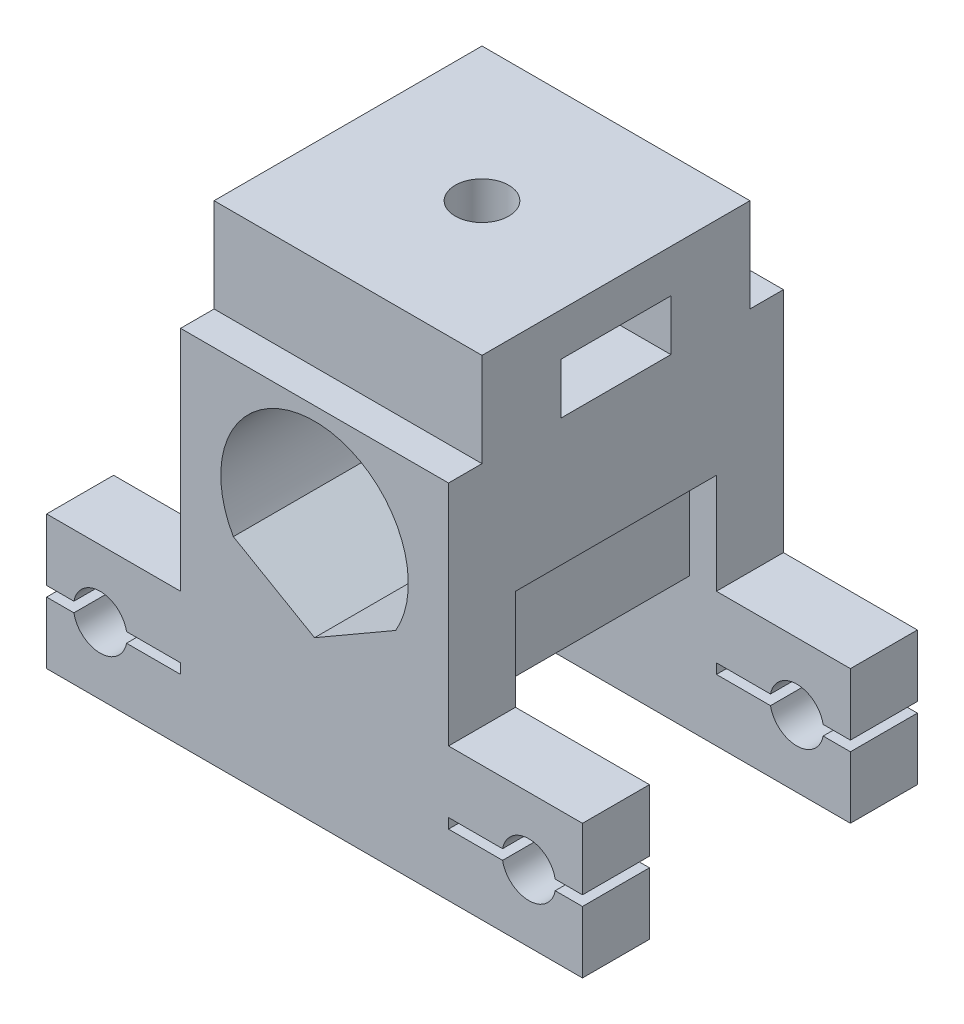
from build123d import *

# Parameters (mm, degrees)
SKETCH1_W               = 20
SKETCH1_H               = 25
BOSS_EXTRUDE1_DEPTH     = 17
CUT_EXTRUDE1_DEPTH      = 32.843366656
BOSS_EXTRUDE2_DEPTH     = 5
SKETCH4_R               = 2
CUT_EXTRUDE2_DEPTH      = 37.249137921
SKETCH6_W               = 20
SKETCH6_H               = 20
BOSS_EXTRUDE3_DEPTH     = 7
SKETCH8_W               = 8.2
SKETCH8_H               = 3.8
CUT_EXTRUDE3_DEPTH      = 41.401113846
CUT_EXTRUDE4_REACH      = 43.379
CUT_EXTRUDE4_END_RADIUS = 7
SKETCH7_R               = 2
SKETCH9_W               = 15
SKETCH9_H               = 7.5
CUT_EXTRUDE5_DEPTH      = 2
SKETCH10_W              = 10
SKETCH10_H              = 0.75
CUT_EXTRUDE6_DEPTH      = 41.01249811


with BuildPart() as part:
    # Sketch1 → Boss-Extrude1 (new body)
    with BuildSketch(Plane(origin=(0, 0, 0), x_dir=(1, 0, 0), z_dir=(0, 1, 0))):
        Rectangle(SKETCH1_W, SKETCH1_H)
    extrude(amount=BOSS_EXTRUDE1_DEPTH)

    # Sketch2 → Cut-Extrude1 (cut, through all)
    with BuildSketch(Plane.XY.offset(12.5)):
        with BuildLine():
            Line((0, 2), (-6.062177826, 5.5))
            ThreePointArc((-6.062177826, 5.5), (0, 16), (6.062177826, 5.5))
            Line((6.062177826, 5.5), (0, 2))
        make_face()
    extrude(amount=-CUT_EXTRUDE1_DEPTH, mode=Mode.SUBTRACT)

    # Sketch3 → Boss-Extrude2 (add)
    with BuildSketch(Plane.XY.offset(12.5)):
        Polygon((10, 0), (20, 0), (20, -10), (-20, -10), (-20, 0), (-10, 0), align=None)
    boss_extrude2 = extrude(amount=-BOSS_EXTRUDE2_DEPTH)

    # Mirror1: Boss-Extrude2 across plane
    add(boss_extrude2.mirror(Plane.XY))

    # Sketch4 → Cut-Extrude2 (cut, through all)
    with BuildSketch(Plane.XY.offset(12.5)):
        with Locations((16, -5)):
            Circle(SKETCH4_R)
        with Locations((-16, -5)):
            Circle(SKETCH4_R)
    extrude(amount=-CUT_EXTRUDE2_DEPTH, mode=Mode.SUBTRACT)

    # Sketch6 → Boss-Extrude3 (add)
    with BuildSketch(Plane(origin=(0, 17, 0), x_dir=(1, 0, 0), z_dir=(0, 1, 0))):
        Rectangle(SKETCH6_W, SKETCH6_H)
    extrude(amount=BOSS_EXTRUDE3_DEPTH)

    # Sketch8 → Cut-Extrude3 (cut, through all)
    with BuildSketch(Plane(origin=(10, 0, 0), x_dir=(0, 0, -1), z_dir=(1, 0, 0))):
        with Locations((0, 18.9)):
            Rectangle(SKETCH8_W, SKETCH8_H)
    extrude(amount=-CUT_EXTRUDE3_DEPTH, mode=Mode.SUBTRACT)

    # Cut-Extrude4: up to this cylinder (the profile starts outside it)
    cut_extrude4_end = Plane(origin=(0, 9, 0), z_dir=(0, 0, 1)) * Cylinder(CUT_EXTRUDE4_END_RADIUS, 101.758, mode=Mode.PRIVATE)
    # Sketch7 → Cut-Extrude4 (cut, up to the surface)
    with BuildSketch(Plane(origin=(0, 24, 0), x_dir=(1, 0, 0), z_dir=(0, 1, 0)), mode=Mode.PRIVATE) as cut_extrude4_sk1:
        with Locations(Location((0, 0, 0), (0, 0, 270))):
            Circle(SKETCH7_R)
    cut_extrude4_tool1 = extrude(cut_extrude4_sk1.sketch, amount=-CUT_EXTRUDE4_REACH, mode=Mode.PRIVATE) - cut_extrude4_end
    add(cut_extrude4_tool1.solids().sort_by_distance((0, 24, 0))[0], mode=Mode.SUBTRACT)

    # Sketch9 → Cut-Extrude5 (cut)
    with BuildSketch(Plane.ZY.offset(-10)):
        with Locations((0, 3.75)):
            Rectangle(SKETCH9_W, SKETCH9_H)
    extrude(amount=CUT_EXTRUDE5_DEPTH, mode=Mode.SUBTRACT)

    # Sketch10 → Cut-Extrude6 (cut, through all)
    with BuildSketch(Plane.XY.offset(12.5)):
        with Locations((-15, -5)):
            Rectangle(SKETCH10_W, SKETCH10_H)
        with Locations((15, -5)):
            Rectangle(SKETCH10_W, SKETCH10_H)
    extrude(amount=-CUT_EXTRUDE6_DEPTH, mode=Mode.SUBTRACT)


solid = part.part
